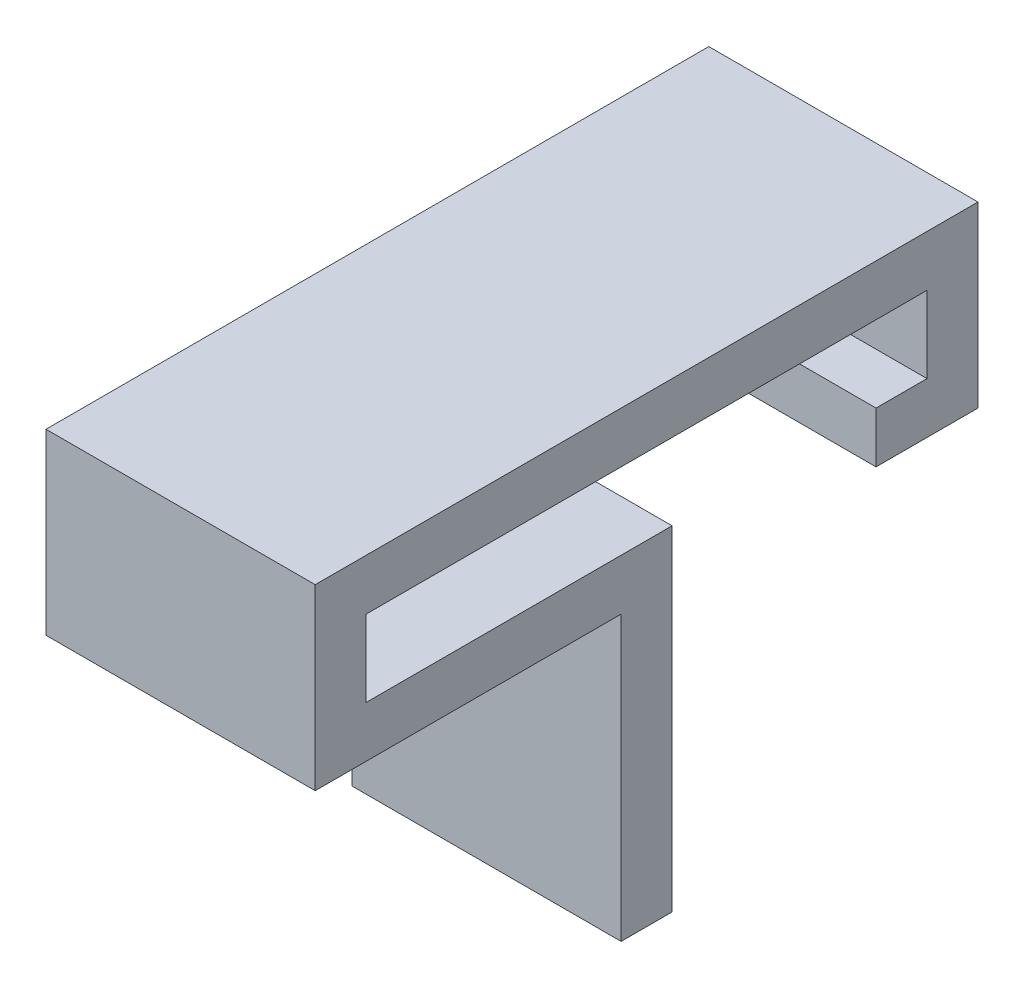
from build123d import *

# Parameters (mm, degrees)
SKETCH1_W           = 26.4
SKETCH1_H           = 32.8
BOSS_EXTRUDE1_DEPTH = 5
SKETCH2_W           = 26.4
SKETCH2_H           = 5
BOSS_EXTRUDE2_DEPTH = 30
SKETCH3_W           = 26.4
SKETCH3_H           = 5
BOSS_EXTRUDE3_DEPTH = 12.5
SKETCH4_W           = 26.4
SKETCH4_H           = 5
BOSS_EXTRUDE4_DEPTH = 60
SKETCH5_W           = 26.4
SKETCH5_H           = 5
BOSS_EXTRUDE5_DEPTH = 12.5
SKETCH6_W           = 26.4
SKETCH6_H           = 5
BOSS_EXTRUDE8_DEPTH = 5


with BuildPart() as part:
    # Sketch1 → Boss-Extrude1 (new body)
    with BuildSketch(Plane.XY):
        with Locations((-3.092887029, -2.09539749)):
            Rectangle(SKETCH1_W, SKETCH1_H)
    extrude(amount=BOSS_EXTRUDE1_DEPTH)

    # Sketch2 → Boss-Extrude2 (add)
    with BuildSketch(Plane.XY.offset(5)):
        with Locations((-3.092887029, 11.80460251)):
            Rectangle(SKETCH2_W, SKETCH2_H)
    extrude(amount=BOSS_EXTRUDE2_DEPTH)

    # Sketch3 → Boss-Extrude3 (add)
    with BuildSketch(Plane(origin=(0, 14.30460251, 0), x_dir=(1, 0, 0), z_dir=(0, 1, 0))):
        with Locations((-3.092887029, -32.5)):
            Rectangle(SKETCH3_W, SKETCH3_H)
    extrude(amount=BOSS_EXTRUDE3_DEPTH)

    # Sketch4 → Boss-Extrude4 (add)
    with BuildSketch(Plane(origin=(0, 0, 30), x_dir=(-1, 0, 0), z_dir=(0, 0, -1))):
        with Locations((3.092887029, 24.30460251)):
            Rectangle(SKETCH4_W, SKETCH4_H)
    extrude(amount=BOSS_EXTRUDE4_DEPTH)

    # Sketch5 → Boss-Extrude5 (add)
    with BuildSketch(Plane.XZ.offset(-21.80460251)):
        with Locations((-3.092887029, -27.5)):
            Rectangle(SKETCH5_W, SKETCH5_H)
    extrude(amount=BOSS_EXTRUDE5_DEPTH)

    # Sketch6 → Boss-Extrude8 (add)
    with BuildSketch(Plane.XY.offset(-25)):
        with Locations((-3.092887029, 11.80460251)):
            Rectangle(SKETCH6_W, SKETCH6_H)
    extrude(amount=BOSS_EXTRUDE8_DEPTH)


solid = part.part
